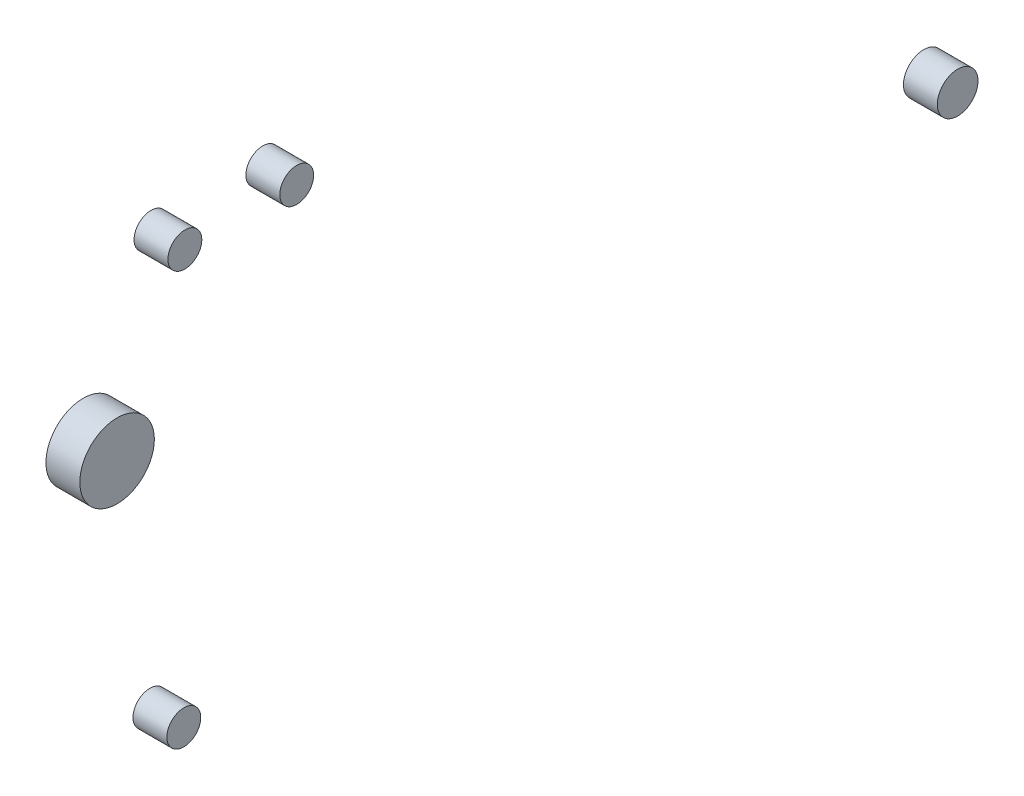
from build123d import *

# Parameters (mm, degrees)
SKETCH1_R             = 1.27
BOSS_EXTRUDE1_DEPTH   = 2.54
SKETCH1_R_2           = 2.794
BOSS_EXTRUDE1_2_DEPTH = 2.54
SKETCH1_R_3           = 1.524
BOSS_EXTRUDE1_3_DEPTH = 2.54
BOSS_EXTRUDE1_4_DEPTH = 2.54
BOSS_EXTRUDE1_5_DEPTH = 2.54


with BuildPart() as part:
    # Sketch1 → Boss-Extrude1 (new body)
    with BuildSketch(Plane(origin=(0, 0, 0), x_dir=(0, 0, -1), z_dir=(1, 0, 0))):
        Circle(SKETCH1_R)
    extrude(amount=BOSS_EXTRUDE1_DEPTH)


with BuildPart() as body_2:
    # Sketch1 → Boss-Extrude1 2 (new body)
    with BuildSketch(Plane(origin=(0, 0, 0), x_dir=(0, 0, -1), z_dir=(1, 0, 0))):
        with Locations((-5, 19.8)):
            Circle(SKETCH1_R_2)
    extrude(amount=BOSS_EXTRUDE1_2_DEPTH)


with BuildPart() as body_3:
    # Sketch1 → Boss-Extrude1 3 (new body)
    with BuildSketch(Plane(origin=(0, 0, 0), x_dir=(0, 0, -1), z_dir=(1, 0, 0))):
        with Locations((58, 12.2)):
            Circle(SKETCH1_R_3)
    extrude(amount=BOSS_EXTRUDE1_3_DEPTH)


with BuildPart() as body_4:
    # Sketch1 → Boss-Extrude1 4 (new body)
    with BuildSketch(Plane(origin=(0, 0, 0), x_dir=(0, 0, -1), z_dir=(1, 0, 0))):
        with Locations((0.08, 30.976)):
            Circle(SKETCH1_R)
    extrude(amount=BOSS_EXTRUDE1_4_DEPTH)


with BuildPart() as body_5:
    # Sketch1 → Boss-Extrude1 5 (new body)
    with BuildSketch(Plane(origin=(0, 0, 0), x_dir=(0, 0, -1), z_dir=(1, 0, 0))):
        with Locations((8.462, 30.976)):
            Circle(SKETCH1_R)
    extrude(amount=BOSS_EXTRUDE1_5_DEPTH)


solid = Compound([part.part, body_2.part, body_3.part, body_4.part, body_5.part])
